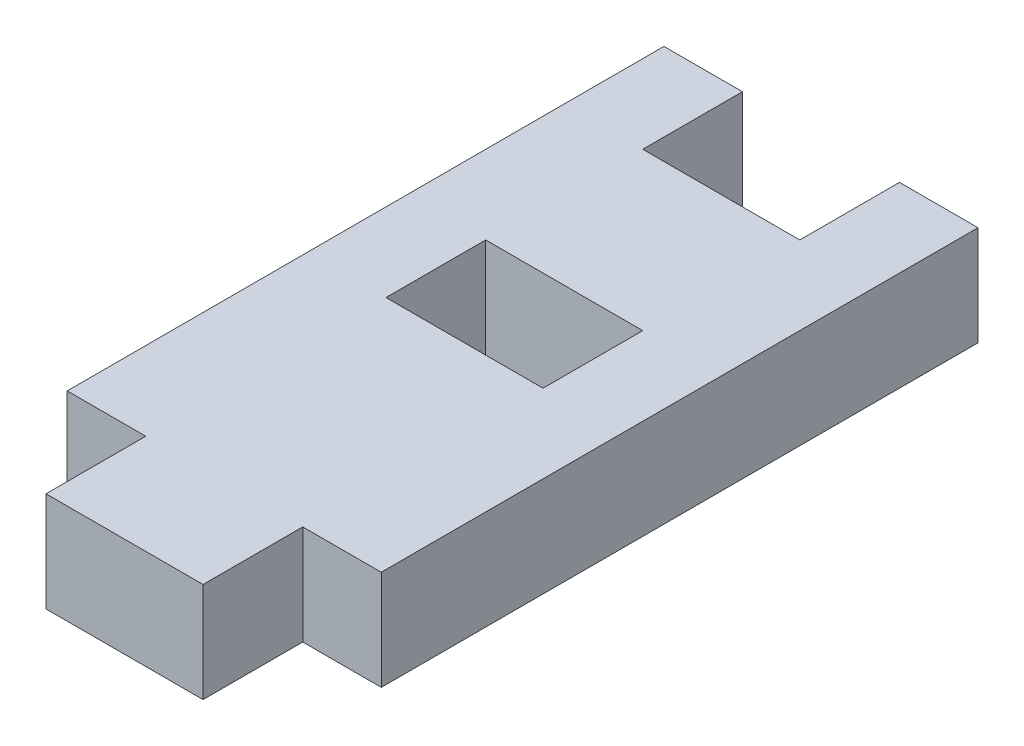
from build123d import *

# Parameters (mm, degrees)
SKETCH1_W           = 10
SKETCH1_H           = 6.35
BOSS_EXTRUDE1_DEPTH = 6.35


with BuildPart() as part:
    # Sketch1 → Boss-Extrude1 (new body)
    with BuildSketch(Plane(origin=(0, 0, 0), x_dir=(1, 0, 0), z_dir=(0, 1, 0))):
        Polygon((0, 0), (5, 0), (5, -6.35), (15, -6.35), (15, 0), (20, 0), (20, 38), (15, 38), (15, 31.65), (5, 31.65), (5, 38), (0, 38), align=None)
        with Locations((10, 18.475)):
            Rectangle(SKETCH1_W, SKETCH1_H, mode=Mode.SUBTRACT)
    extrude(amount=BOSS_EXTRUDE1_DEPTH)


solid = part.part
